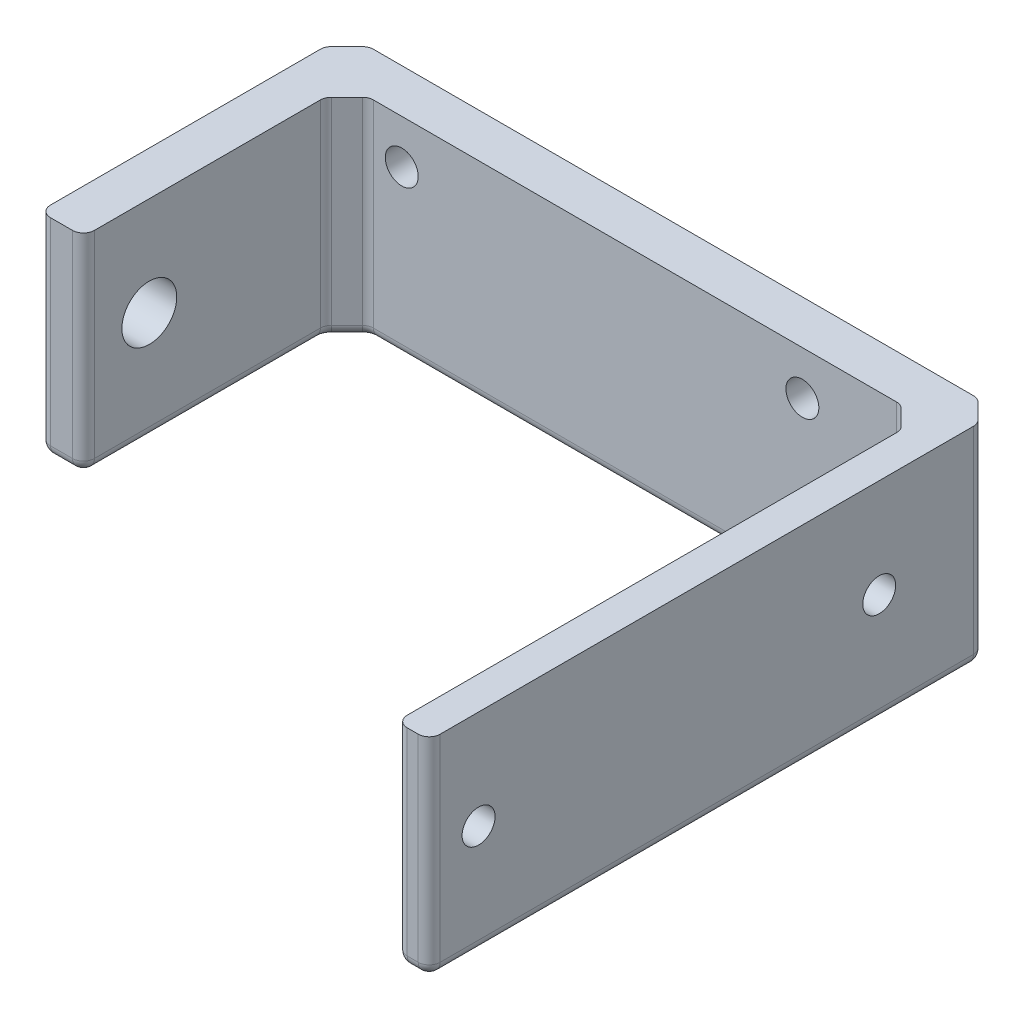
from build123d import *

# Parameters (mm, degrees)
SKETCH_1_W          = 59.5
SKETCH_1_H          = 19
SKETCH_1_R          = 1.5
EXTRUDE_1_DEPTH     = 4
SKETCH_2_W          = 4
SKETCH_2_H          = 19
EXTRUDE_2_DEPTH     = 24
SKETCH_3_W          = 3
SKETCH_3_H          = 19
EXTRUDE_3_DEPTH     = 48
SKETCH_4_R          = 2.5
CUT_EXTRUDE_1_DEPTH = 48
SKETCH_5_R          = 1.5
CUT_EXTRUDE_2_DEPTH = 48
CHAMFER_1_SIZE      = 2
FILLET_1_R          = 1


with BuildPart() as part:
    # 草图1 → 凸台-拉伸1 (new body)
    with BuildSketch(Plane.XY):
        with Locations((10.493245584, -4.144948765)):
            Rectangle(SKETCH_1_W, SKETCH_1_H)
        with Locations((-10.256754416, 1.355051235)):
            Circle(SKETCH_1_R, mode=Mode.SUBTRACT)
        with Locations((26.243245584, 1.355051235)):
            Circle(SKETCH_1_R, mode=Mode.SUBTRACT)
    extrude(amount=EXTRUDE_1_DEPTH)

    # 草图2 → 凸台-拉伸2 (add)
    with BuildSketch(Plane.XY.offset(4)):
        with Locations((-17.256754416, -4.144948765)):
            Rectangle(SKETCH_2_W, SKETCH_2_H)
    extrude(amount=EXTRUDE_2_DEPTH)

    # 草图3 → 凸台-拉伸3 (add)
    with BuildSketch(Plane.XY.offset(4)):
        with Locations((38.743245584, -4.144948765)):
            Rectangle(SKETCH_3_W, SKETCH_3_H)
    extrude(amount=EXTRUDE_3_DEPTH)

    # 草图4 → 切除-拉伸1 (cut)
    with BuildSketch(Plane(origin=(-15.256754416, 0, 0), x_dir=(0, 0, -1), z_dir=(1, 0, 0))):
        with Locations((-22, -3.644948765)):
            Circle(SKETCH_4_R)
    extrude(amount=-CUT_EXTRUDE_1_DEPTH, mode=Mode.SUBTRACT)

    # 草图5 → 切除-拉伸2 (cut)
    with BuildSketch(Plane.ZY.offset(-37.243245584)):
        with Locations((11, -3.644948765)):
            Circle(SKETCH_5_R)
        with Locations((47.5, -3.644948765)):
            Circle(SKETCH_5_R)
    extrude(amount=-CUT_EXTRUDE_2_DEPTH, mode=Mode.SUBTRACT)

    # 倒角1
    chamfer_1_edges = [part.edges().sort_by_distance(p)[0] for p in [
        (-15.256754416, -4.144948765, 4),
        (37.243245584, -4.144948765, 4),
        (-19.256754416, -4.144948765, 0),
        (40.243245584, -4.144948765, 0),
    ]]
    chamfer(chamfer_1_edges, length=CHAMFER_1_SIZE)

    # 圆角1
    fillet_1_edges = [part.edges().sort_by_distance(p)[0] for p in [
        (-17.256754416, -13.644948765, 28),
        (-15.256754416, -4.144948765, 28),
        (-15.256754416, -13.644948765, 17),
        (-19.256754416, -4.144948765, 28),
        (37.243245584, -13.644948765, 29),
        (37.243245584, -4.144948765, 52),
        (38.743245584, -13.644948765, 52),
        (40.243245584, -4.144948765, 52),
        (40.243245584, -4.144948765, 2),
        (10.493245584, -13.644948765, 0),
        (-17.256754416, -4.144948765, 0),
        (38.243245584, -4.144948765, 0),
        (10.993245584, -13.644948765, 4),
        (-18.256754416, -13.644948765, 1),
        (39.243245584, -13.644948765, 1),
        (-19.256754416, -4.144948765, 2),
        (37.243245584, -4.144948765, 6),
        (-13.256754416, -4.144948765, 4),
        (35.243245584, -4.144948765, 4),
        (-15.256754416, -4.144948765, 6),
        (40.243245584, -13.644948765, 27),
        (36.243245584, -13.644948765, 5),
        (-19.256754416, -13.644948765, 15),
        (-14.256754416, -13.644948765, 5),
    ]]
    fillet(fillet_1_edges, radius=FILLET_1_R)


solid = part.part
